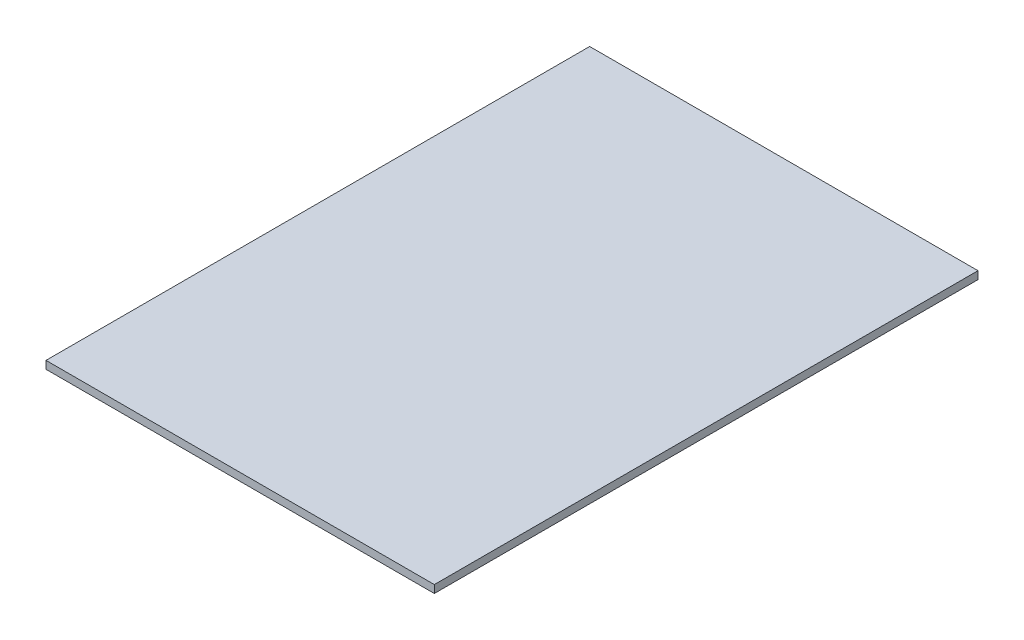
from build123d import *

# Parameters (mm, degrees)
SKETCH1_W           = 250
SKETCH1_H           = 350
BOSS_EXTRUDE1_DEPTH = 5


with BuildPart() as part:
    # Sketch1 → Boss-Extrude1 (new body)
    with BuildSketch(Plane(origin=(0, 0, 0), x_dir=(1, 0, 0), z_dir=(0, 1, 0))):
        with Locations((125, 175)):
            Rectangle(SKETCH1_W, SKETCH1_H)
    extrude(amount=BOSS_EXTRUDE1_DEPTH)


solid = part.part
